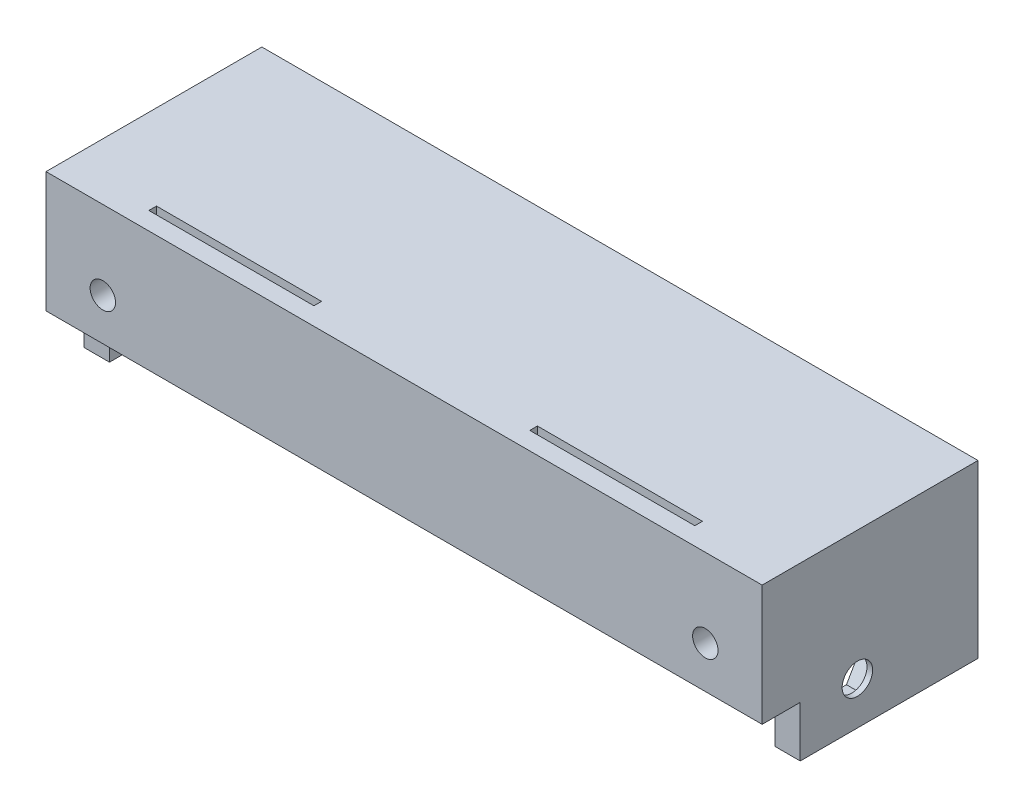
from build123d import *

# Parameters (mm, degrees)
SCHIZZO1_W                   = 56.4
SCHIZZO1_H                   = 9.5
SCHIZZO1_R                   = 1
ESTRUSIONE_ESTRUSIONE1_DEPTH = 3
SCHIZZO2_W                   = 56.4
SCHIZZO2_H                   = 3
ESTRUSIONE_ESTRUSIONE2_DEPTH = 14
SCHIZZO3_W                   = 14
SCHIZZO3_H                   = 10.5
ESTRUSIONE_ESTRUSIONE3_DEPTH = 2
FORO_PER_VITE_M2_1_D         = 2.4
FORO_PER_VITE_M2_1_DEPTH     = 56.4
TAGLIO_ESTRUSIONE1_DEPTH     = 1.56
TAGLIO_ESTRUSIONE3_START     = -9.5
SCHIZZO8_W                   = 13
SCHIZZO8_H                   = 0.6
TAGLIO_ESTRUSIONE3_DEPTH     = 9.5


with BuildPart() as part:
    # Schizzo1 → Estrusione-Estrusione1 (new body)
    with BuildSketch(Plane.XY):
        with Locations((0, -4.75)):
            Rectangle(SCHIZZO1_W, SCHIZZO1_H)
        with Locations((-23.725, -6.2)):
            Circle(SCHIZZO1_R, mode=Mode.SUBTRACT)
        with Locations(Location((23.725, -6.2, 0), (0, 0, 180))):
            Circle(SCHIZZO1_R, mode=Mode.SUBTRACT)
    extrude(amount=ESTRUSIONE_ESTRUSIONE1_DEPTH)

    # Schizzo2 → Estrusione-Estrusione2 (add)
    with BuildSketch(Plane(origin=(0, 0, 0), x_dir=(-1, 0, 0), z_dir=(0, 0, -1))):
        with Locations((0, -1.5)):
            Rectangle(SCHIZZO2_W, SCHIZZO2_H)
    extrude(amount=ESTRUSIONE_ESTRUSIONE2_DEPTH)

    # Schizzo3 → Estrusione-Estrusione3 (add)
    with BuildSketch(Plane(origin=(28.2, 0, 0), x_dir=(0, 0, -1), z_dir=(1, 0, 0))):
        with Locations((7, -8.25)):
            Rectangle(SCHIZZO3_W, SCHIZZO3_H)
    estrusione_estrusione3 = extrude(amount=-ESTRUSIONE_ESTRUSIONE3_DEPTH)

    # Foro per Vite M2-1
    with Locations(Plane(origin=(28.2, 0, 0), x_dir=(0, 0, -1), z_dir=(1, 0, 0))):
        with Locations((4.5, -10.14)):
            foro_per_vite_m2_1 = Hole(FORO_PER_VITE_M2_1_D / 2, depth=FORO_PER_VITE_M2_1_DEPTH)

    # Schizzo6 → Taglio-Estrusione1 (cut)
    with BuildSketch(Plane.ZY.offset(-26.2)):
        Polygon((-5.640266782, -8.165), (-6.780533563, -10.14), (-5.640266782, -12.115), (-3.359733218, -12.115), (-2.219466437, -10.14), (-3.359733218, -8.165), align=None)
    taglio_estrusione1 = extrude(amount=-TAGLIO_ESTRUSIONE1_DEPTH, mode=Mode.SUBTRACT)

    # Specchia2: Estrusione-Estrusione3, Foro per Vite M2-1, Taglio-Estrusione1 across plane
    add(estrusione_estrusione3.mirror(Plane(origin=(0, 0, 0), x_dir=(0, 0, 1), z_dir=(1, 0, 0))))
    add(foro_per_vite_m2_1.mirror(Plane(origin=(0, 0, 0), x_dir=(0, 0, 1), z_dir=(1, 0, 0))), mode=Mode.SUBTRACT)
    add(taglio_estrusione1.mirror(Plane(origin=(0, 0, 0), x_dir=(0, 0, 1), z_dir=(1, 0, 0))), mode=Mode.SUBTRACT)

    # Schizzo8 → Taglio-Estrusione3 (cut)
    with BuildSketch(Plane(origin=(0, 0, -9), x_dir=(1, 0, 0), z_dir=(0, 1, 0)).offset(TAGLIO_ESTRUSIONE3_START)):
        with Locations((15, -10.3)):
            Rectangle(SCHIZZO8_W, SCHIZZO8_H)
        with Locations((-15, -10.3)):
            Rectangle(SCHIZZO8_W, SCHIZZO8_H)
    extrude(amount=TAGLIO_ESTRUSIONE3_DEPTH, mode=Mode.SUBTRACT)


solid = part.part
